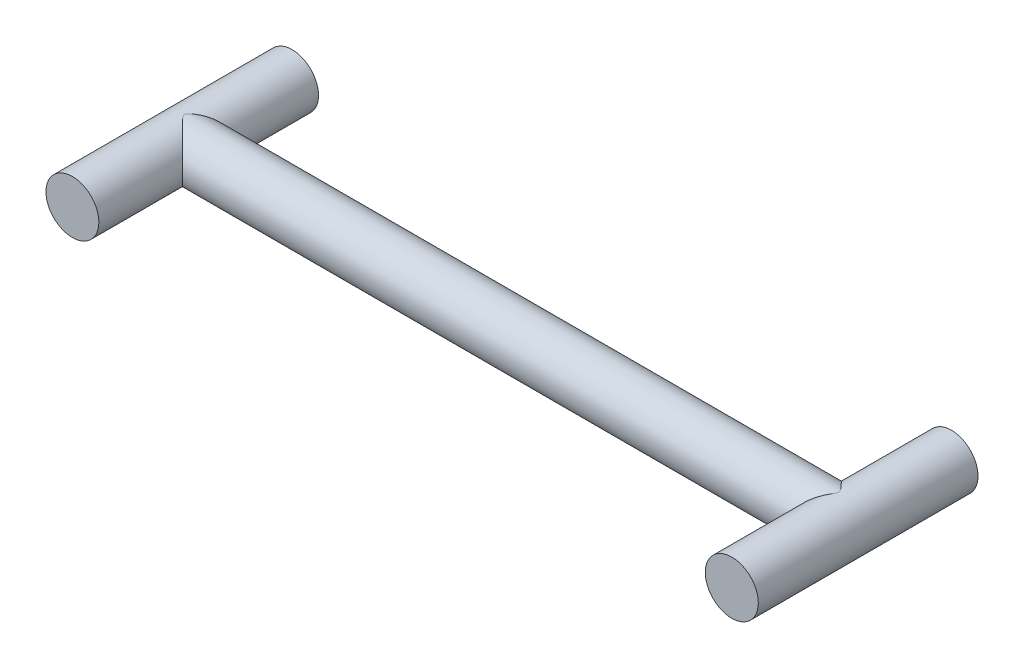
from build123d import *

# Parameters (mm, degrees)
SKETCH_1_R      = 0.6
EXTRUDE_1_DEPTH = 15
SKETCH_2_R      = 0.60381225
SKETCH_2_R_2    = 0.602112423
EXTRUDE_2_DEPTH = 2.5


with BuildPart() as part:
    # 草图1 → 凸台-拉伸1 (new body)
    with BuildSketch(Plane(origin=(0, 0, 0), x_dir=(0, 0, -1), z_dir=(1, 0, 0))):
        Circle(SKETCH_1_R)
    extrude(amount=EXTRUDE_1_DEPTH)

    # 草图2 → 凸台-拉伸2 (add, symmetric)
    with BuildSketch(Plane.XY):
        with Locations((15.00822403, 0)):
            Circle(SKETCH_2_R)
        Circle(SKETCH_2_R_2)
    extrude(amount=EXTRUDE_2_DEPTH, both=True)


solid = part.part
